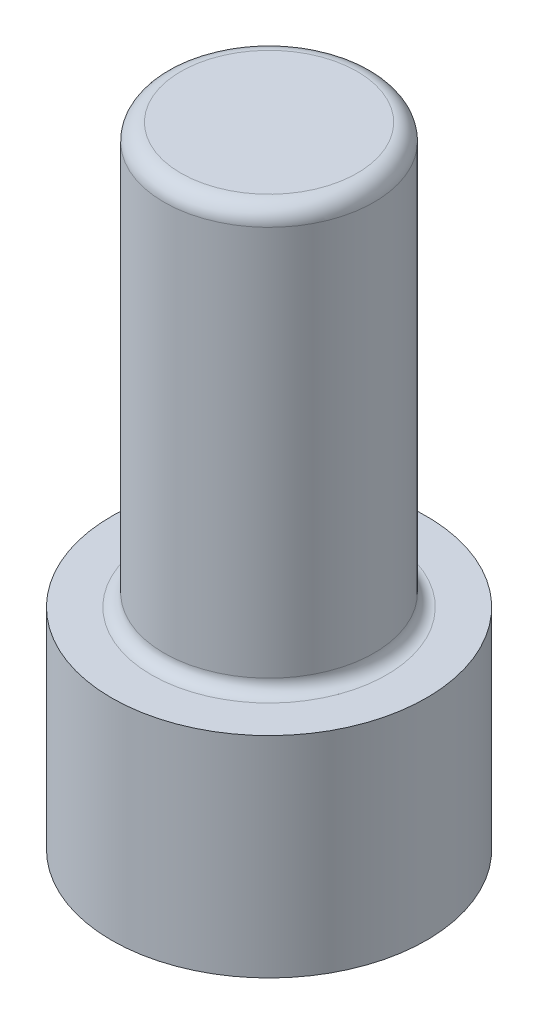
from build123d import *

# Parameters (mm, degrees)
SKETCH1_R           = 187.5
BOSS_EXTRUDE1_DEPTH = 250
SKETCH2_R           = 125
BOSS_EXTRUDE2_DEPTH = 500
FILLET1_R           = 15
FILLET2_R           = 20
CUT_EXTRUDE1_DEPTH  = 150


with BuildPart() as part:
    # Sketch1 → Boss-Extrude1 (new body)
    with BuildSketch(Plane(origin=(0, 0, 0), x_dir=(1, 0, 0), z_dir=(0, 1, 0))):
        with Locations(Location((0, 0, 0), (0, 0, 270))):
            Circle(SKETCH1_R)
    extrude(amount=BOSS_EXTRUDE1_DEPTH)

    # Sketch2 → Boss-Extrude2 (add)
    with BuildSketch(Plane(origin=(0, 250, 0), x_dir=(1, 0, 0), z_dir=(0, 1, 0))):
        with Locations(Location((0, 0, 0), (0, 0, 270))):
            Circle(SKETCH2_R)
    extrude(amount=BOSS_EXTRUDE2_DEPTH)

    # Fillet1
    fillet1_edges = [part.edges().sort_by_distance(p)[0] for p in [
        (0, 250, -125),
    ]]
    fillet(fillet1_edges, radius=FILLET1_R)

    # Fillet2
    fillet2_edges = [part.edges().sort_by_distance(p)[0] for p in [
        (0, 750, -125),
    ]]
    fillet(fillet2_edges, radius=FILLET2_R)

    # Sketch3 → Cut-Extrude1 (cut)
    with BuildSketch(Plane(origin=(0, 0, 0), x_dir=(-1, 0, 0), z_dir=(0, -1, 0))):
        Polygon((97.214244703, -31.619988955), (75.990836054, 68.380011045), (-21.223408649, 100), (-97.214244703, 31.619988955), (-75.990836054, -68.380011045), (21.223408649, -100), align=None)
    extrude(amount=-CUT_EXTRUDE1_DEPTH, mode=Mode.SUBTRACT)


solid = part.part
